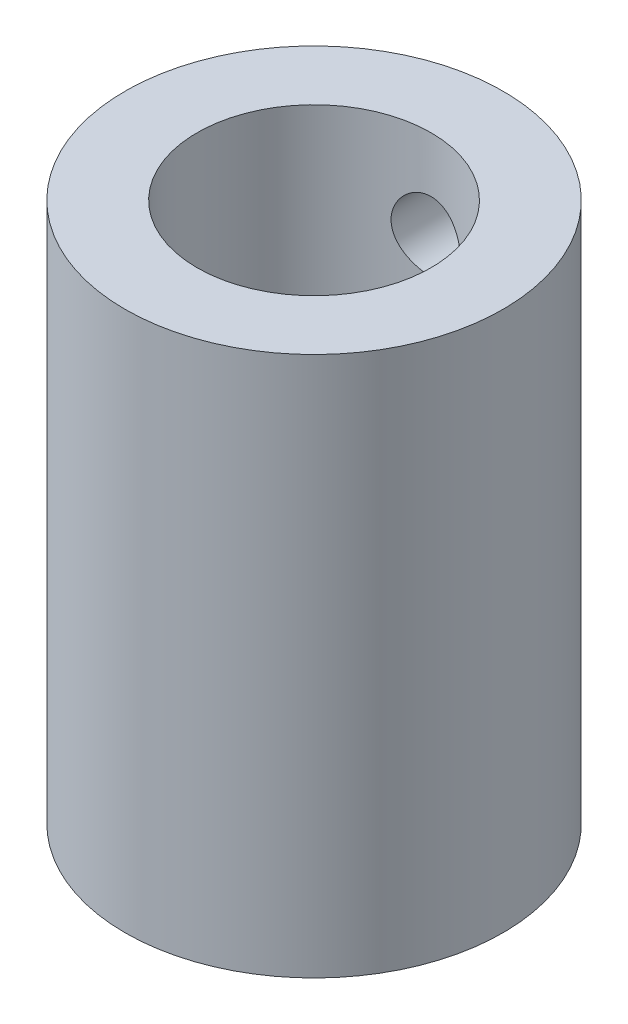
from build123d import *

# Parameters (mm, degrees)
ESQUISSE1_R              = 5.25
ESQUISSE1_R_2            = 3.25
BASE_DEPTH               = 15
VIDE_GOUPILLE_REACH      = 18.737
VIDE_GOUPILLE_END_RADIUS = 5.25
ESQUISSE2_R              = 0.964762098


with BuildPart() as part:
    # Esquisse1 → BASE (new body)
    with BuildSketch(Plane(origin=(0, 0, 0), x_dir=(1, 0, 0), z_dir=(0, 1, 0))):
        with Locations(Location((0, 0, 0), (0, 0, 270))):
            Circle(ESQUISSE1_R)
        with Locations(Location((0, 0, 0), (0, 0, 270))):
            Circle(ESQUISSE1_R_2, mode=Mode.SUBTRACT)
    extrude(amount=BASE_DEPTH)

    # VIDE GOUPILLE: up to this cylinder (the profile starts inside it)
    vide_goupille_end = Plane(origin=(0, 12.5, 0), z_dir=(0, -1, 0)) * Cylinder(VIDE_GOUPILLE_END_RADIUS, 48.974, mode=Mode.PRIVATE)
    # Esquisse2 → VIDE GOUPILLE (cut, up to the surface)
    with BuildSketch(Plane.XY, mode=Mode.PRIVATE) as vide_goupille_sk1:
        with Locations((0, 12.5)):
            Circle(ESQUISSE2_R)
    vide_goupille_tool1 = extrude(vide_goupille_sk1.sketch, amount=-VIDE_GOUPILLE_REACH, mode=Mode.PRIVATE) & vide_goupille_end
    add(vide_goupille_tool1.solids().sort_by_distance((0, 12.5, 0))[0], mode=Mode.SUBTRACT)


solid = part.part
